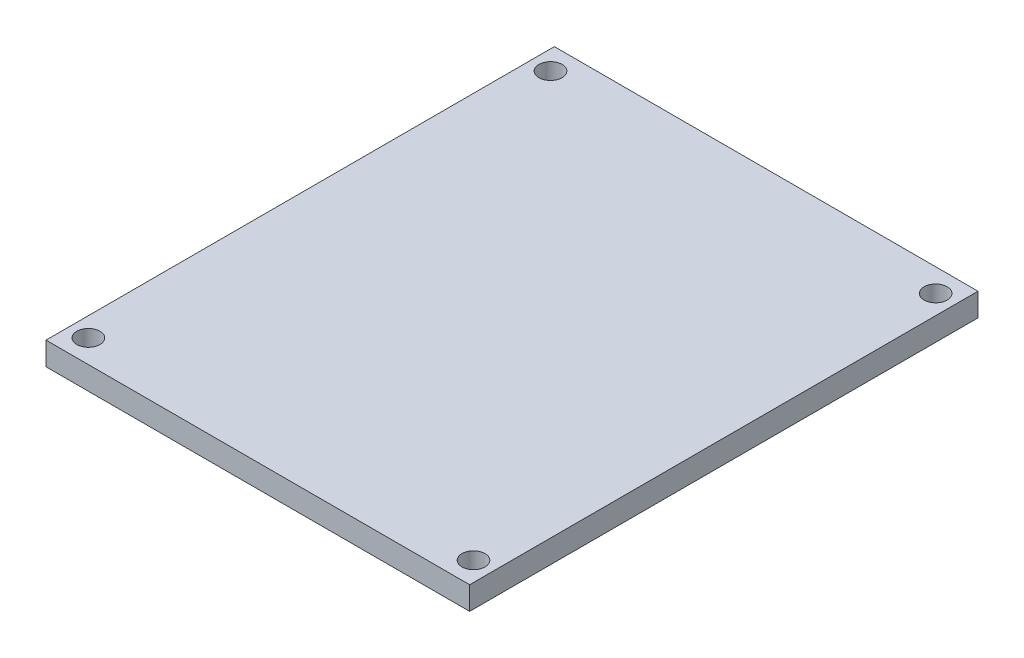
from build123d import *

# Parameters (mm, degrees)
ESQUISSE1_W        = 55
ESQUISSE1_H        = 66
ESQUISSE1_R        = 1.5
BOSS_EXTRU_1_DEPTH = 3


with BuildPart() as part:
    # Esquisse1 → Boss.-Extru.1 (new body)
    with BuildSketch(Plane(origin=(0, 0, 0), x_dir=(1, 0, 0), z_dir=(0, 1, 0))):
        Rectangle(ESQUISSE1_W, ESQUISSE1_H)
        with Locations(Location((-25, 30, 0), (0, 0, 270))):
            Circle(ESQUISSE1_R, mode=Mode.SUBTRACT)
        with Locations(Location((25, 30, 0), (0, 0, 270))):
            Circle(ESQUISSE1_R, mode=Mode.SUBTRACT)
        with Locations(Location((25, -30, 0), (0, 0, 270))):
            Circle(ESQUISSE1_R, mode=Mode.SUBTRACT)
        with Locations(Location((-25, -30, 0), (0, 0, 270))):
            Circle(ESQUISSE1_R, mode=Mode.SUBTRACT)
    extrude(amount=BOSS_EXTRU_1_DEPTH)


solid = part.part
